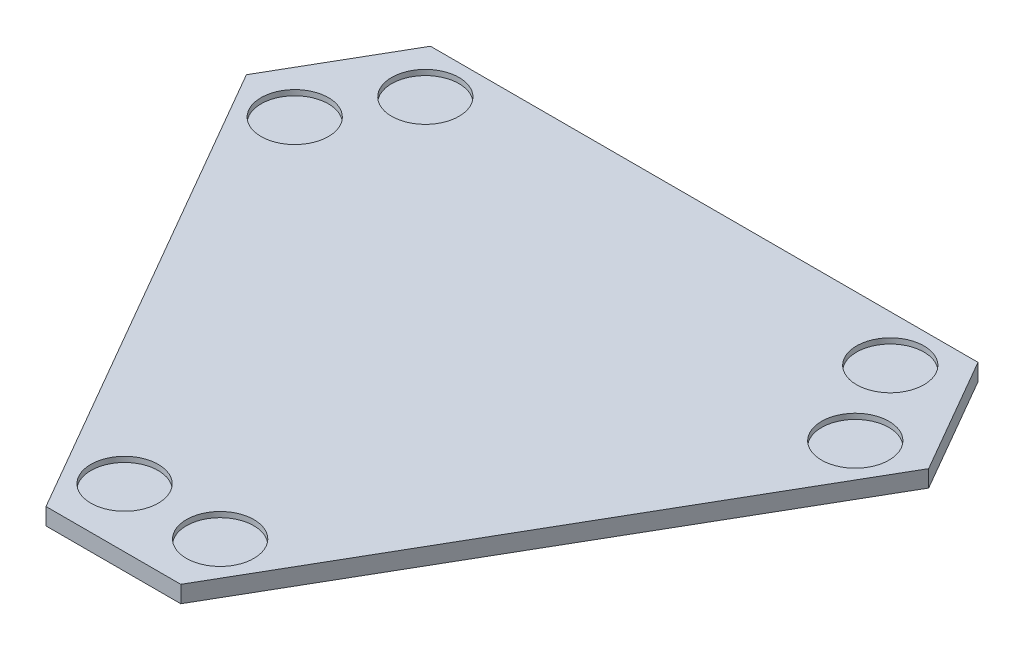
from build123d import *

# Parameters (mm, degrees)
BOSS_EXTRUDE1_DEPTH = 5
CUT_EXTRUDE4_START  = 5
SKETCH1_5_R         = 10
CUT_EXTRUDE4_DEPTH  = 1.6
CIRPATTERN1_COUNT   = 3


with BuildPart() as part:
    # Sketch1 → Boss-Extrude1 (new body)
    with BuildSketch(Plane(origin=(0, 0, 0), x_dir=(1, 0, 0), z_dir=(0, 1, 0))):
        Polygon((20, -105.358983849), (101.24355653, 35.358983849), (81.24355653, 70), (-81.24355653, 70), (-101.24355653, 35.358983849), (-20, -105.358983849), align=None)
    extrude(amount=BOSS_EXTRUDE1_DEPTH)

    # Sketch1<5> → Cut-Extrude4 (cut)
    with BuildSketch(Plane(origin=(0, 0, 0), x_dir=(1, 0, 0), z_dir=(0, 1, 0)).offset(CUT_EXTRUDE4_START)):
        with Locations(Location((-14.186994533, -87.858983849, 0), (0, 0, 270))):
            Circle(SKETCH1_5_R)
        with Locations(Location((14.186994533, -87.858983849, 0), (0, 0, 270))):
            Circle(SKETCH1_5_R)
    cut_extrude4 = extrude(amount=-CUT_EXTRUDE4_DEPTH, mode=Mode.SUBTRACT)

    # CirPattern1: Cut-Extrude4 ×3 about axis
    cirpattern1_axis = Axis((0, 0, 0), (0, 1, 0))
    for i in range(1, CIRPATTERN1_COUNT):
        add(cut_extrude4.rotate(cirpattern1_axis, i * 360 / CIRPATTERN1_COUNT), mode=Mode.SUBTRACT)


solid = part.part
